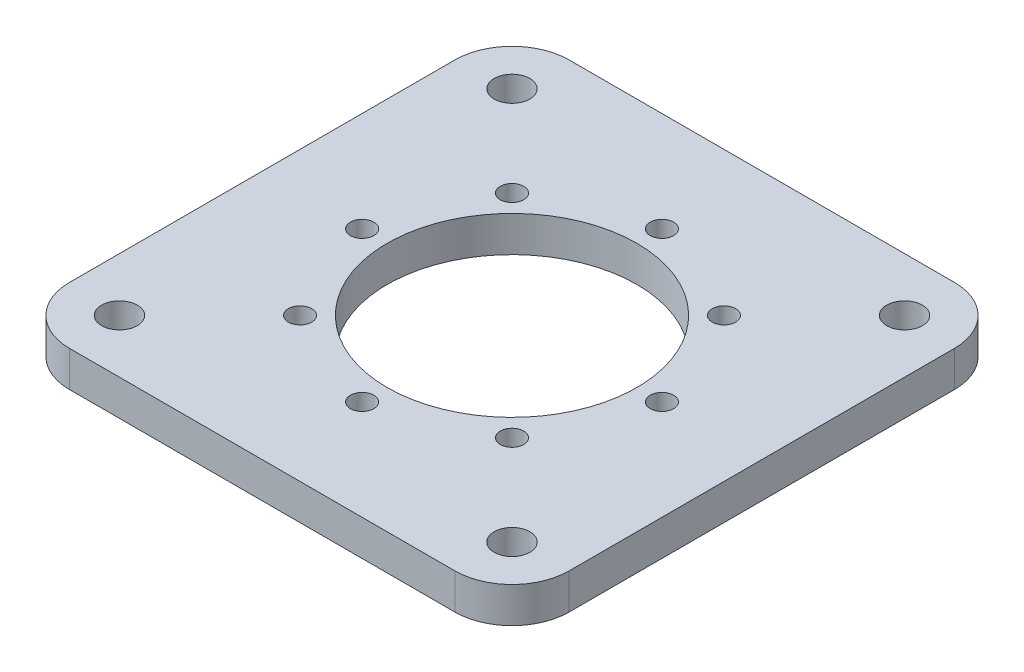
from build123d import *

# Parameters (mm, degrees)
SKETCH2_R           = 22.225
SKETCH2_R_2         = 3.175
BOSS_EXTRUDE1_DEPTH = 6.35
SKETCH3_R           = 2.0828
CUT_EXTRUDE1_DEPTH  = 6.35


with BuildPart() as part:
    # Sketch2 → Boss-Extrude1 (new body)
    with BuildSketch(Plane(origin=(0, 0, 0), x_dir=(1, 0, 0), z_dir=(0, 1, 0))):
        with BuildLine():
            Line((-34.29, -44.45), (34.29, -44.45))
            ThreePointArc((34.29, -44.45), (41.474204897, -41.474204897), (44.45, -34.29))
            Line((44.45, -34.29), (44.45, 34.29))
            ThreePointArc((44.45, 34.29), (41.474204897, 41.474204897), (34.29, 44.45))
            Line((34.29, 44.45), (-34.29, 44.45))
            ThreePointArc((-34.29, 44.45), (-41.474204897, 41.474204897), (-44.45, 34.29))
            Line((-44.45, 34.29), (-44.45, -34.29))
            ThreePointArc((-44.45, -34.29), (-41.474204897, -41.474204897), (-34.29, -44.45))
        make_face()
        with Locations(Location((0, 0, 0), (0, 0, 270))):
            Circle(SKETCH2_R, mode=Mode.SUBTRACT)
        with Locations(Location((-34.925, 34.925, 0), (0, 0, 270))):
            Circle(SKETCH2_R_2, mode=Mode.SUBTRACT)
        with Locations(Location((34.925, 34.925, 0), (0, 0, 90))):
            Circle(SKETCH2_R_2, mode=Mode.SUBTRACT)
        with Locations(Location((34.925, -34.925, 0), (0, 0, 270))):
            Circle(SKETCH2_R_2, mode=Mode.SUBTRACT)
        with Locations(Location((-34.925, -34.925, 0), (0, 0, 90))):
            Circle(SKETCH2_R_2, mode=Mode.SUBTRACT)
    extrude(amount=BOSS_EXTRUDE1_DEPTH)

    # Sketch3 → Cut-Extrude1 (cut)
    with BuildSketch(Plane(origin=(0, 6.35, 0), x_dir=(1, 0, 0), z_dir=(0, 1, 0))):
        with Locations(Location((26.67, 0, 0), (0, 0, 270))):
            Circle(SKETCH3_R)
        with Locations(Location((18.858537854, -18.858537854, 0), (0, 0, 270))):
            Circle(SKETCH3_R)
        with Locations(Location((0, -26.67, 0), (0, 0, 270))):
            Circle(SKETCH3_R)
        with Locations(Location((-18.858537854, -18.858537854, 0), (0, 0, 270))):
            Circle(SKETCH3_R)
        with Locations(Location((-26.67, 0, 0), (0, 0, 270))):
            Circle(SKETCH3_R)
        with Locations(Location((-18.858537854, 18.858537854, 0), (0, 0, 270))):
            Circle(SKETCH3_R)
        with Locations(Location((0, 26.67, 0), (0, 0, 270))):
            Circle(SKETCH3_R)
        with Locations(Location((18.858537854, 18.858537854, 0), (0, 0, 270))):
            Circle(SKETCH3_R)
    extrude(amount=-CUT_EXTRUDE1_DEPTH, mode=Mode.SUBTRACT)


solid = part.part
